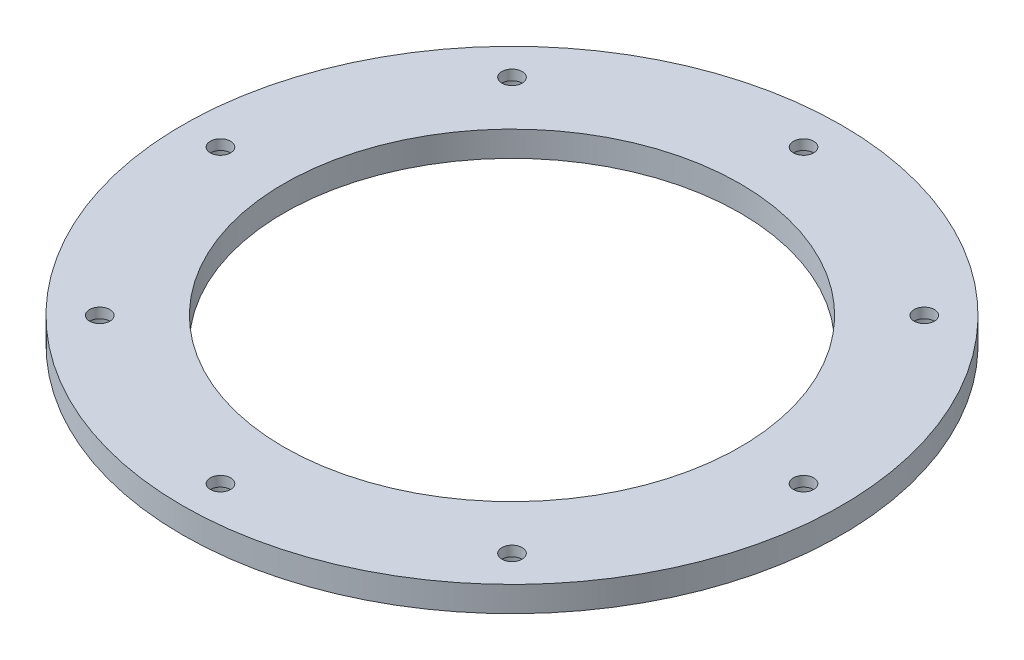
from build123d import *

# Parameters (mm, degrees)
SKETCH1_R                      = 130
SKETCH1_R_2                    = 90
BOSS_EXTRUDE1_DEPTH            = 10
SKETCH2_R                      = 7.5
CUT_EXTRUDE1_DEPTH             = 6
CUT_EXTRUDE2_REACH             = 185.946
SKETCH3_R                      = 4
CUT_EXTRUDE2_DIRECTION_2_DEPTH = 184.945644145
CIRPATTERN1_COUNT              = 8


with BuildPart() as part:
    # Sketch1 → Boss-Extrude1 (new body)
    with BuildSketch(Plane(origin=(0, 0, 0), x_dir=(1, 0, 0), z_dir=(0, 1, 0))):
        with Locations(Location((0, 0, 0), (0, 0, 270))):
            Circle(SKETCH1_R)
        with Locations(Location((0, 0, 0), (0, 0, 270))):
            Circle(SKETCH1_R_2, mode=Mode.SUBTRACT)
    extrude(amount=BOSS_EXTRUDE1_DEPTH)

    # Sketch2 → Cut-Extrude1 (cut)
    with BuildSketch(Plane.XZ):
        with Locations(Location((0, 115, 0), (0, 0, 270))):
            Circle(SKETCH2_R)
    cut_extrude1 = extrude(amount=-CUT_EXTRUDE1_DEPTH, mode=Mode.SUBTRACT)

    # Sketch3 → Cut-Extrude2 (cut, up to next)
    with BuildSketch(Plane.XZ.offset(-6), mode=Mode.PRIVATE) as cut_extrude2_sk1:
        with Locations(Location((0, 115, 0), (0, 0, 90))):
            Circle(SKETCH3_R)
    cut_extrude2_tool1 = extrude(cut_extrude2_sk1.sketch, amount=-CUT_EXTRUDE2_REACH, mode=Mode.PRIVATE) & part.part
    cut_extrude2 = cut_extrude2_tool1.solids().sort_by_distance((0, 6, 115))[0]
    add(cut_extrude2, mode=Mode.SUBTRACT)

    # Sketch3 → Cut-Extrude2 direction 2 (cut)
    with BuildSketch(Plane.XZ.offset(-6)):
        with Locations(Location((0, 115, 0), (0, 0, 90))):
            Circle(SKETCH3_R)
    cut_extrude2_direction_2 = extrude(amount=CUT_EXTRUDE2_DIRECTION_2_DEPTH, mode=Mode.SUBTRACT)

    # CirPattern1: Cut-Extrude1, Cut-Extrude2, Cut-Extrude2 direction 2 ×8 about axis
    cirpattern1_axis = Axis((0, 0, 0), (0, 1, 0))
    add([cut_extrude1.rotate(cirpattern1_axis, i * 360 / CIRPATTERN1_COUNT) for i in range(1, CIRPATTERN1_COUNT)], mode=Mode.SUBTRACT)
    add([cut_extrude2.rotate(cirpattern1_axis, i * 360 / CIRPATTERN1_COUNT) for i in range(1, CIRPATTERN1_COUNT)], mode=Mode.SUBTRACT)
    add([cut_extrude2_direction_2.rotate(cirpattern1_axis, i * 360 / CIRPATTERN1_COUNT) for i in range(1, CIRPATTERN1_COUNT)], mode=Mode.SUBTRACT)


solid = part.part
